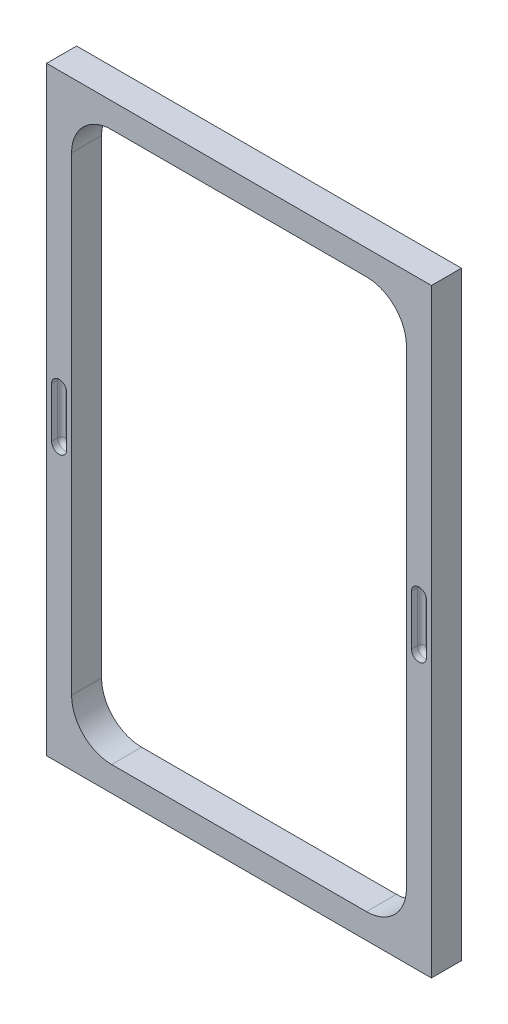
from build123d import *

# Parameters (mm, degrees)
SKETCH1_W           = 977.9
SKETCH1_H           = 1524
BOSS_EXTRUDE1_DEPTH = 76.2
CUT_EXTRUDE1_DEPTH  = 25.4
FILLET1_R           = 10.16


with BuildPart() as part:
    # Sketch1 → Boss-Extrude1 (new body)
    with BuildSketch(Plane.XY):
        with Locations((488.95, 762)):
            Rectangle(SKETCH1_W, SKETCH1_H)
        with BuildLine():
            Line((63.5, 165.1), (63.5, 1358.9))
            ThreePointArc((63.5, 1358.9), (93.257951031, 1430.742048969), (165.1, 1460.5))
            Line((165.1, 1460.5), (812.8, 1460.5))
            ThreePointArc((812.8, 1460.5), (884.642048969, 1430.742048969), (914.4, 1358.9))
            Line((914.4, 1358.9), (914.4, 165.1))
            ThreePointArc((914.4, 165.1), (884.642048969, 93.257951031), (812.8, 63.5))
            Line((812.8, 63.5), (165.1, 63.5))
            ThreePointArc((165.1, 63.5), (93.257951031, 93.257951031), (63.5, 165.1))
        make_face(mode=Mode.SUBTRACT)
    extrude(amount=BOSS_EXTRUDE1_DEPTH)

    # Sketch2 → Cut-Extrude1 (cut)
    with BuildSketch(Plane.XY.offset(76.2)):
        with BuildLine():
            Line((50.8, 825.5), (50.8, 698.5))
            ThreePointArc((50.8, 698.5), (31.75, 679.45), (12.7, 698.5))
            Line((12.7, 698.5), (12.7, 825.5))
            ThreePointArc((12.7, 825.5), (31.75, 844.55), (50.8, 825.5))
        make_face()
        with BuildLine():
            Line((927.1, 825.5), (927.1, 698.5))
            ThreePointArc((927.1, 698.5), (946.15, 679.45), (965.2, 698.5))
            Line((965.2, 698.5), (965.2, 825.5))
            ThreePointArc((965.2, 825.5), (946.15, 844.55), (927.1, 825.5))
        make_face()
    extrude(amount=-CUT_EXTRUDE1_DEPTH, mode=Mode.SUBTRACT)

    # Fillet1
    fillet1_edges = [part.edges().sort_by_distance(p)[0] for p in [
        (31.75, 844.55, 50.8),
        (50.8, 762, 50.8),
        (31.75, 679.45, 50.8),
        (12.7, 762, 50.8),
        (946.15, 844.55, 50.8),
        (965.2, 762, 50.8),
        (946.15, 679.45, 50.8),
        (927.1, 762, 50.8),
    ]]
    fillet(fillet1_edges, radius=FILLET1_R)


solid = part.part
